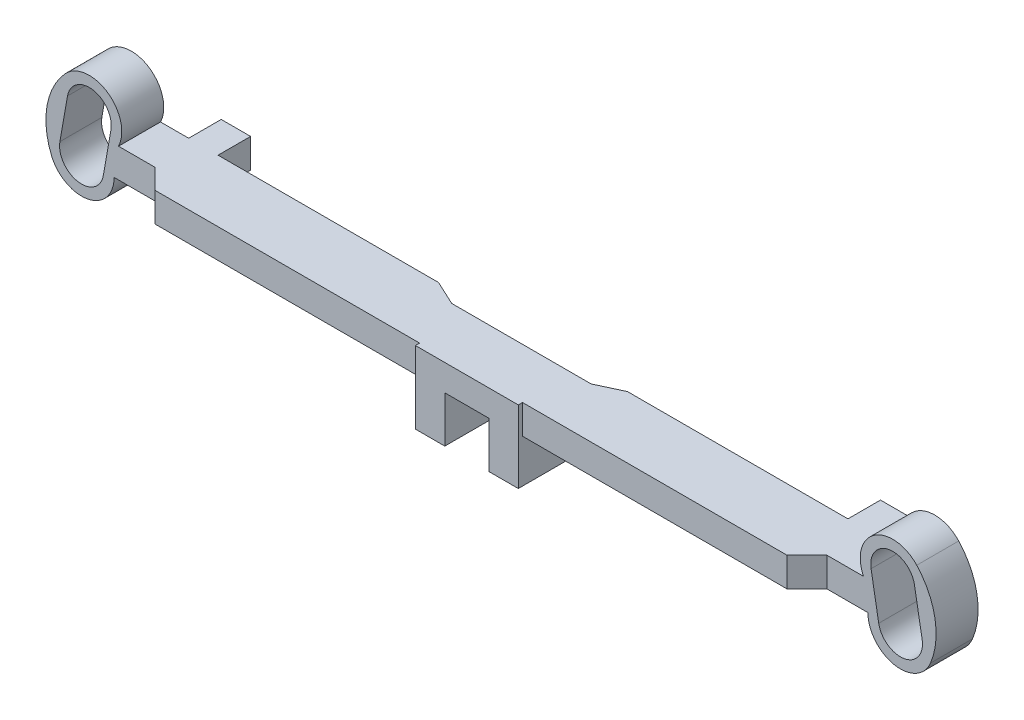
from build123d import *

# Parameters (mm, degrees)
BOSS_EXTRU_1_DEPTH      = 2
BOSS_EXTRU_2_DEPTH      = 1.39125117
ENL_V_MAT_EXTRU_1_DEPTH = 2
BOSS_EXTRU_3_DEPTH      = 0.2
BOSS_EXTRU_3_DEPTH_BACK = 2.4
ESQUISSE4_W             = 4.9
ESQUISSE4_H             = 3.45
ESQUISSE5_W             = 2.1
ESQUISSE5_H             = 2.2
ENL_V_MAT_EXTRU_2_DEPTH = 4
ESQUISSE6_W             = 1.4
ESQUISSE6_H             = 1.55
BOSS_EXTRU_4_DEPTH      = 1.39125117
SCALE1_SCALE            = 6.5


with BuildPart() as part:
    # Esquisse1 → Boss.-Extru.1 (new body)
    with BuildSketch(Plane.XY):
        with BuildLine():
            Line((-17.95, 0), (17.95, 0))
            ThreePointArc((17.95, 0), (19.19656242, -1.520008433), (20.931194368, -0.595132491))
            ThreePointArc((20.931194368, -0.595132491), (21.146292286, 1.356483691), (20.276674314, 3.116835194))
            ThreePointArc((20.276674314, 3.116835194), (18.263317154, 3.349532273), (17.740928308, 1.39125117))
            Line((17.740928308, 1.39125117), (-17.740928308, 1.39125117))
            ThreePointArc((-17.740928308, 1.39125117), (-18.263317154, 3.349532273), (-20.276674314, 3.116835194))
            ThreePointArc((-20.276674314, 3.116835194), (-21.146292286, 1.356483691), (-20.931194368, -0.595132491))
            ThreePointArc((-20.931194368, -0.595132491), (-19.19656242, -1.520008433), (-17.95, 0))
        make_face()
        with BuildLine():
            Line((-20.534048141, 0.182330587), (-20.169386968, 2.250426868))
            ThreePointArc((-20.169386968, 2.250426868), (-18.95300824, 3.102144422), (-18.101290686, 1.885765695))
            Line((-18.101290686, 1.885765695), (-18.465951859, -0.182330587))
            ThreePointArc((-18.465951859, -0.182330587), (-19.682330587, -1.034048141), (-20.534048141, 0.182330587))
        make_face(mode=Mode.SUBTRACT)
        with BuildLine():
            Line((18.465951859, -0.182330587), (18.101290686, 1.885765695))
            ThreePointArc((18.101290686, 1.885765695), (18.95300824, 3.102144422), (20.169386968, 2.250426868))
            Line((20.169386968, 2.250426868), (20.534048141, 0.182330587))
            ThreePointArc((20.534048141, 0.182330587), (19.682330587, -1.034048141), (18.465951859, -0.182330587))
        make_face(mode=Mode.SUBTRACT)
    extrude(amount=BOSS_EXTRU_1_DEPTH)

    # Esquisse2 → Boss.-Extru.2 (add)
    with BuildSketch(Plane.XZ):
        Polygon((-16, 2), (-15.05, 2.95), (15.05, 2.95), (16, 2), align=None)
    extrude(amount=-BOSS_EXTRU_2_DEPTH)

    # Esquisse3 → Enlèv. mat.-Extru.1 (cut)
    with BuildSketch(Plane.XZ):
        Polygon((-4.5, 0), (-3.320521194, 0.55), (3.320521194, 0.55), (4.5, 0), align=None)
    extrude(amount=-ENL_V_MAT_EXTRU_1_DEPTH, mode=Mode.SUBTRACT)

    # Esquisse4 → Boss.-Extru.3 (add, two sides: drawn at the far end of the back side and taken through both)
    with BuildSketch(Plane.XY.offset(2.95).offset(-BOSS_EXTRU_3_DEPTH_BACK)):
        with Locations((0, -0.33374883)):
            Rectangle(ESQUISSE4_W, ESQUISSE4_H)
    extrude(amount=BOSS_EXTRU_3_DEPTH + BOSS_EXTRU_3_DEPTH_BACK)

    # Esquisse5 → Enlèv. mat.-Extru.2 (cut)
    with BuildSketch(Plane.XY.offset(3.15)):
        with Locations((0, -0.95874883)):
            Rectangle(ESQUISSE5_W, ESQUISSE5_H)
    extrude(amount=-ENL_V_MAT_EXTRU_2_DEPTH, mode=Mode.SUBTRACT)

    # Esquisse6 → Boss.-Extru.4 (add)
    with BuildSketch(Plane(origin=(0, 1.39125117, 0), x_dir=(1, 0, 0), z_dir=(0, 1, 0))):
        with Locations((-15.7, 0.775)):
            Rectangle(ESQUISSE6_W, ESQUISSE6_H)
        with Locations((15.7, 0.775)):
            Rectangle(ESQUISSE6_W, ESQUISSE6_H)
    extrude(amount=-BOSS_EXTRU_4_DEPTH)


with BuildPart() as part_1:
    # Scale1: scaled about (0, 0.610214787, 1.376752435)
    add(part.part.scale(SCALE1_SCALE).moved(Location((0, -3.356181328, -7.572138393))))


solid = part_1.part
